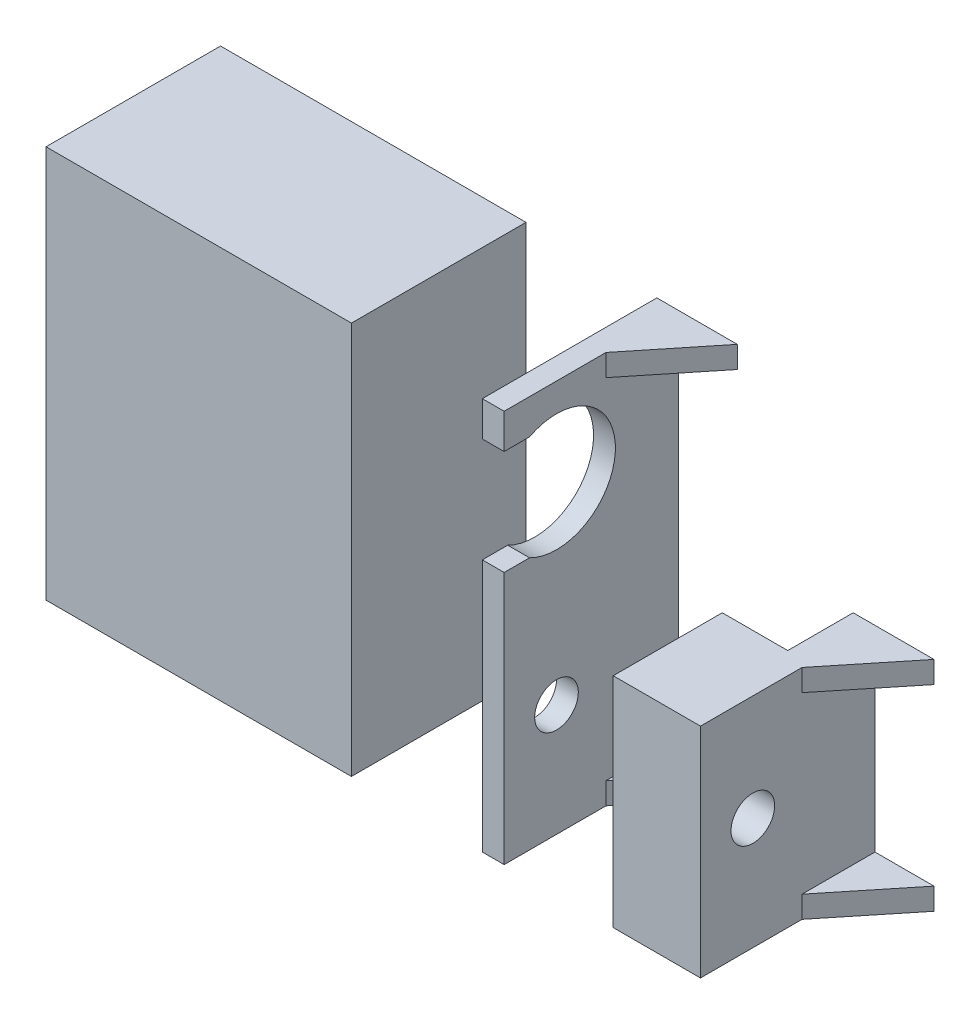
from build123d import *

# Parameters (mm, degrees)
SKETCH1_W            = 300
SKETCH1_H            = 200
BOSS_EXTRUDE1_DEPTH  = 5
SKETCH3_W            = 20
SKETCH3_H            = 20
SKETCH3_H_2          = 40
CUT_EXTRUDE1_DEPTH   = 5
SKETCH4_W            = 20
SKETCH4_H            = 40
CUT_EXTRUDE2_DEPTH   = 10
SKETCH6_W            = 300
SKETCH6_H            = 200
BOSS_EXTRUDE2_DEPTH  = 5
BOSS_EXTRUDE4_DEPTH  = 40
SKETCH8_3_W          = 5
SKETCH8_3_H          = 40
BOSS_EXTRUDE5_DEPTH  = 40
CUT_EXTRUDE3_DEPTH   = 236
SKETCH10_R           = 5
CUT_EXTRUDE4_DEPTH   = 236
BOSS_EXTRUDE6_DEPTH  = 5
BOSS_EXTRUDE7_DEPTH  = 5
BOSS_EXTRUDE8_DEPTH  = 5
CUT_EXTRUDE5_DEPTH   = 10
SKETCH19_W           = 25
SKETCH19_H           = 50
BOSS_EXTRUDE10_DEPTH = 15
BOSS_EXTRUDE11_DEPTH = 5
SKETCH22_R           = 5
CUT_EXTRUDE6_DEPTH   = 39
SKETCH23_R           = 13.5
CUT_EXTRUDE7_DEPTH   = 10
SKETCH25_W           = 300
SKETCH25_H           = 200
SKETCH25_W_2         = 63.516764864
SKETCH25_H_2         = 90
CUT_EXTRUDE8_DEPTH   = 195
SKETCH25_2_W         = 300
SKETCH25_2_H         = 200
CUT_EXTRUDE9_DEPTH   = 195
SKETCH26_W           = 40
SKETCH26_H           = 90
BOSS_EXTRUDE12_DEPTH = 70


with BuildPart() as part:
    # Sketch1 → Boss-Extrude1 (new body)
    with BuildSketch(Plane.XY):
        Rectangle(SKETCH1_W, SKETCH1_H)
    extrude(amount=BOSS_EXTRUDE1_DEPTH)

    # Sketch3 → Cut-Extrude1 (cut)
    with BuildSketch(Plane.XY.offset(5)):
        with Locations((-140, -90)):
            Rectangle(SKETCH3_W, SKETCH3_H)
        with Locations((-140, 80)):
            Rectangle(SKETCH3_W, SKETCH3_H_2)
        with Locations((140, 80)):
            Rectangle(SKETCH3_W, SKETCH3_H_2)
        with Locations((140, -90)):
            Rectangle(SKETCH3_W, SKETCH3_H)
    extrude(amount=-CUT_EXTRUDE1_DEPTH, mode=Mode.SUBTRACT)

    # Sketch4 → Cut-Extrude2 (cut)
    with BuildSketch(Plane(origin=(0, 0, 0), x_dir=(-1, 0, 0), z_dir=(0, 0, -1))):
        with Locations((-140, -80)):
            Rectangle(SKETCH4_W, SKETCH4_H)
        with Locations((140, -80)):
            Rectangle(SKETCH4_W, SKETCH4_H)
    extrude(amount=-CUT_EXTRUDE2_DEPTH, mode=Mode.SUBTRACT)

    # Sketch6 → Boss-Extrude2 (add)
    with BuildSketch(Plane(origin=(0, 0, 0), x_dir=(-1, 0, 0), z_dir=(0, 0, -1))):
        Rectangle(SKETCH6_W, SKETCH6_H)
    extrude(amount=-BOSS_EXTRUDE2_DEPTH)

    # Sketch8 → Boss-Extrude4 (add)
    with BuildSketch(Plane.XY.offset(5)):
        Polygon((-100, 20), (-95, 20), (-95, -20), (-95, -70), (-100, -70), (-100, -20), align=None)
    boss_extrude4 = extrude(amount=BOSS_EXTRUDE4_DEPTH)

    # Sketch8<3> → Boss-Extrude5 (add)
    with BuildSketch(Plane.XY.offset(5)):
        with Locations((57.5, 0)):
            Rectangle(SKETCH8_3_W, SKETCH8_3_H)
    extrude(amount=BOSS_EXTRUDE5_DEPTH)

    # Sketch9 → Cut-Extrude3 (cut)
    with BuildSketch(Plane(origin=(60, 0, 0), x_dir=(0, 0, -1), z_dir=(1, 0, 0))):
        with BuildLine():
            Line((-45, 12), (-33, 12))
            ThreePointArc((-33, 12), (-21, 0), (-33, -12))
            Line((-33, -12), (-45, -12))
            Line((-45, -12), (-45, 12))
        make_face()
    extrude(amount=-CUT_EXTRUDE3_DEPTH, mode=Mode.SUBTRACT)

    # Sketch10 → Cut-Extrude4 (cut)
    with BuildSketch(Plane(origin=(-95, 0, 0), x_dir=(0, 0, -1), z_dir=(1, 0, 0))):
        with Locations((-33, -44.279864558)):
            Circle(SKETCH10_R)
    cut_extrude4 = extrude(amount=-CUT_EXTRUDE4_DEPTH, mode=Mode.SUBTRACT)

    # Sketch11 → Boss-Extrude6 (add)
    with BuildSketch(Plane.XZ.offset(70)):
        Polygon((-95, 21.66038922), (-81.566809401, 5), (-95, 5), align=None)
    extrude(amount=-BOSS_EXTRUDE6_DEPTH)

    # Sketch12 → Boss-Extrude7 (add)
    with BuildSketch(Plane(origin=(0, 20, 0), x_dir=(1, 0, 0), z_dir=(0, 1, 0))):
        Polygon((60, -21), (73.767048753, -5), (60, -5), align=None)
    boss_extrude7 = extrude(amount=-BOSS_EXTRUDE7_DEPTH)

    # Sketch12<3> → Boss-Extrude8 (add)
    with BuildSketch(Plane(origin=(0, 20, 0), x_dir=(1, 0, 0), z_dir=(0, 1, 0))):
        Polygon((-81.566809401, -5), (-95, -21.66038922), (-95, -5), align=None)
    extrude(amount=-BOSS_EXTRUDE8_DEPTH)

    # Mirror1: Boss-Extrude7 across plane
    add(boss_extrude7.mirror(Plane(origin=(0, 0, 0), x_dir=(0, 0, 1), z_dir=(0, -1, 0))))

    # Mirror3: Boss-Extrude4, Cut-Extrude4 across plane
    add(boss_extrude4.mirror(Plane(origin=(-75, 0, 0), x_dir=(0, 0, 1), z_dir=(1, 0, 0))))
    add(cut_extrude4.mirror(Plane(origin=(-75, 0, 0), x_dir=(0, 0, 1), z_dir=(1, 0, 0))), mode=Mode.SUBTRACT)

    # Sketch17 → Cut-Extrude5 (cut)
    with BuildSketch(Plane.ZY.offset(55)):
        Polygon((5, -20), (45, -20), (45, -12), (45, 20), (5, 20), align=None)
    extrude(amount=-CUT_EXTRUDE5_DEPTH, mode=Mode.SUBTRACT)

    # Sketch19 → Boss-Extrude10 (add)
    with BuildSketch(Plane.ZY.offset(55)):
        with Locations((32.5, -45)):
            Rectangle(SKETCH19_W, SKETCH19_H)
    extrude(amount=BOSS_EXTRUDE10_DEPTH)

    # Sketch20 → Boss-Extrude11 (add)
    with BuildSketch(Plane.XZ.offset(70)):
        Polygon((-50, 21.717977163), (-36.483235136, 5), (-50, 5), align=None)
    boss_extrude11 = extrude(amount=-BOSS_EXTRUDE11_DEPTH)

    # Mirror4: Boss-Extrude11 across plane
    add(boss_extrude11.mirror(Plane.ZX.offset(-45)))

    # Sketch22 → Cut-Extrude6 (cut)
    with BuildSketch(Plane(origin=(-75, 0, 0), x_dir=(0, 0, -1), z_dir=(1, 0, 0))):
        with Locations((-33, -44.279864558)):
            Circle(SKETCH22_R)
    extrude(amount=CUT_EXTRUDE6_DEPTH, mode=Mode.SUBTRACT)

    # Sketch23 → Cut-Extrude7 (cut)
    with BuildSketch(Plane.ZY.offset(100)):
        with Locations((33, 0)):
            Circle(SKETCH23_R)
    extrude(amount=-CUT_EXTRUDE7_DEPTH, mode=Mode.SUBTRACT)

    # Sketch25 → Cut-Extrude8 (cut)
    with BuildSketch(Plane.XY.offset(5)):
        Rectangle(SKETCH25_W, SKETCH25_H)
        with Locations((-68.241617568, -25)):
            Rectangle(SKETCH25_W_2, SKETCH25_H_2, mode=Mode.SUBTRACT)
    extrude(amount=CUT_EXTRUDE8_DEPTH, mode=Mode.SUBTRACT)

    # Sketch25<2> → Cut-Extrude9 (cut)
    with BuildSketch(Plane.XY.offset(5)):
        Rectangle(SKETCH25_2_W, SKETCH25_2_H)
    extrude(amount=-CUT_EXTRUDE9_DEPTH, mode=Mode.SUBTRACT)


with BuildPart() as cut_extrude9_piece_1:
    # of the separate pieces the step leaves, piece 1, a body of its own (cut_extrude9_pieces)
    add(part.part.solids().sort_by_distance((-50, -70, 21.717977163))[0])


with BuildPart() as cut_extrude9_piece_2:
    # of the separate pieces the step leaves, piece 2, a body of its own (cut_extrude9_pieces)
    add(part.part.solids().sort_by_distance((-81.566809401, 20, 5))[0])


with BuildPart() as body_3:
    # Sketch26 → Boss-Extrude12 (new body)
    with BuildSketch(Plane.ZY.offset(130)):
        with Locations((25, -25)):
            Rectangle(SKETCH26_W, SKETCH26_H)
    extrude(amount=BOSS_EXTRUDE12_DEPTH)


solid = Compound([cut_extrude9_piece_1.part, cut_extrude9_piece_2.part, body_3.part])
